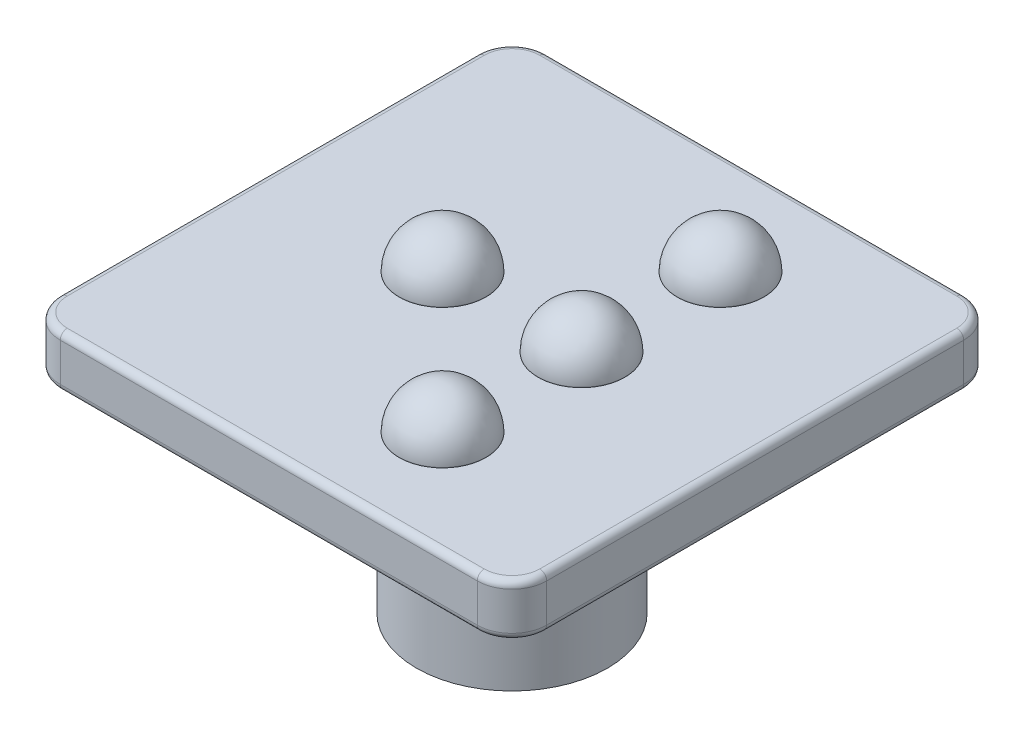
from build123d import *

# Parameters (mm, degrees)
BOSS_EXTRUDE1_DEPTH = 1.5
SKETCH2_R           = 2.75
BOSS_EXTRUDE2_DEPTH = 6
SKETCH3_W           = 1.1
SKETCH3_H           = 1.45
SKETCH3_W_2         = 1.45
SKETCH3_H_2         = 1.1
CUT_EXTRUDE1_DEPTH  = 6
CHAMFER1_SIZE       = 0.3
FILLET1_R           = 1
SKETCH4_R           = 1.25
BOSS_EXTRUDE3_DEPTH = 0.01
DOME2_FACE_RADIUS   = 1.25
DOME2_HEIGHT        = 1.25
DOME3_FACE_RADIUS   = 1.25
DOME3_HEIGHT        = 1.25
DOME4_FACE_RADIUS   = 1.25
DOME4_HEIGHT        = 1.25
DOME6_FACE_RADIUS   = 1.25
DOME6_HEIGHT        = 1.25
FILLET3_R           = 0.2


with BuildPart() as part:
    # Sketch1 → Boss-Extrude1 (new body)
    with BuildSketch(Plane(origin=(0, 0, 0), x_dir=(1, 0, 0), z_dir=(0, 1, 0))):
        with BuildLine():
            Line((-7.324675649, 4.396717546), (4.675324351, 4.396717546))
            ThreePointArc((4.675324351, 4.396717546), (5.382431132, 4.103824327), (5.675324351, 3.396717546))
            Line((5.675324351, 3.396717546), (5.675324351, -8.603282454))
            ThreePointArc((5.675324351, -8.603282454), (5.382431132, -9.310389235), (4.675324351, -9.603282454))
            Line((4.675324351, -9.603282454), (-7.324675649, -9.603282454))
            ThreePointArc((-7.324675649, -9.603282454), (-8.03178243, -9.310389235), (-8.324675649, -8.603282454))
            Line((-8.324675649, -8.603282454), (-8.324675649, 3.396717546))
            ThreePointArc((-8.324675649, 3.396717546), (-8.03178243, 4.103824327), (-7.324675649, 4.396717546))
        make_face()
    extrude(amount=BOSS_EXTRUDE1_DEPTH)

    # Sketch2 → Boss-Extrude2 (add)
    with BuildSketch(Plane.XZ):
        with Locations(Location((-1.324675649, 2.603282454, 0), (0, 0, 270))):
            Circle(SKETCH2_R)
    extrude(amount=BOSS_EXTRUDE2_DEPTH)

    # Sketch3 → Cut-Extrude1 (cut)
    with BuildSketch(Plane.XZ.offset(6)):
        with Locations((-1.324675649, 3.878282454)):
            Rectangle(SKETCH3_W, SKETCH3_H)
        with Locations((-0.049675649, 2.603282454)):
            Rectangle(SKETCH3_W_2, SKETCH3_H_2)
        with Locations((-1.324675649, 2.603282454)):
            Rectangle(SKETCH3_W, SKETCH3_H_2)
        with Locations((-2.599675649, 2.603282454)):
            Rectangle(SKETCH3_W_2, SKETCH3_H_2)
        with Locations((-1.324675649, 1.328282454)):
            Rectangle(SKETCH3_W, SKETCH3_H)
    extrude(amount=-CUT_EXTRUDE1_DEPTH, mode=Mode.SUBTRACT)

    # Chamfer1
    chamfer1_edges = [part.edges().sort_by_distance(p)[0] for p in [
        (-0.774675649, -6, 3.878282454),
        (-0.049675649, -6, 3.153282454),
        (0.675324351, -6, 2.603282454),
        (-0.774675649, -6, 1.328282454),
        (-2.599675649, -6, 3.153282454),
        (-1.324675649, -6, 4.603282454),
        (-1.874675649, -6, 3.878282454),
        (-3.324675649, -6, 2.603282454),
        (-2.599675649, -6, 2.053282454),
        (-1.874675649, -6, 1.328282454),
        (-1.324675649, -6, 0.603282454),
        (-0.049675649, -6, 2.053282454),
    ]]
    chamfer(chamfer1_edges, length=CHAMFER1_SIZE)

    # Fillet1
    fillet1_edges = [part.edges().sort_by_distance(p)[0] for p in [
        (-1.324675649, 0, 5.353282454),
    ]]
    fillet(fillet1_edges, radius=FILLET1_R)

    # Sketch4 → Boss-Extrude3 (add)
    with BuildSketch(Plane(origin=(0, 1.5, 0), x_dir=(1, 0, 0), z_dir=(0, 1, 0))):
        with Locations(Location((0.675324351, -2.603282454, 0), (0, 0, 90))):
            Circle(SKETCH4_R)
        with Locations(Location((-3.324675649, -2.603282454, 0), (0, 0, 90))):
            Circle(SKETCH4_R)
        with Locations(Location((0.675324351, -6.603282454, 0), (0, 0, 90))):
            Circle(SKETCH4_R)
        with Locations(Location((0.675324351, 1.396717546, 0), (0, 0, 90))):
            Circle(SKETCH4_R)
    extrude(amount=BOSS_EXTRUDE3_DEPTH)

    # Dome2: a dome of height H over a round flat face of radius A is a cap of a sphere of radius (A * A + H * H) / (2 * H)
    dome2_r = (DOME2_FACE_RADIUS * DOME2_FACE_RADIUS + DOME2_HEIGHT * DOME2_HEIGHT) / (2 * DOME2_HEIGHT)
    dome2_base = Plane((0.675324351, 1.51, -1.396717546), z_dir=(0, 1, 0))
    with Locations(dome2_base.offset(DOME2_HEIGHT - dome2_r)):
        dome2_ball = Sphere(dome2_r, mode=Mode.PRIVATE)
    add(split(dome2_ball, bisect_by=dome2_base, keep=Keep.TOP, mode=Mode.PRIVATE))

    # Dome3: a dome of height H over a round flat face of radius A is a cap of a sphere of radius (A * A + H * H) / (2 * H)
    dome3_r = (DOME3_FACE_RADIUS * DOME3_FACE_RADIUS + DOME3_HEIGHT * DOME3_HEIGHT) / (2 * DOME3_HEIGHT)
    dome3_base = Plane((-3.324675649, 1.51, 2.603282454), z_dir=(0, 1, 0))
    with Locations(dome3_base.offset(DOME3_HEIGHT - dome3_r)):
        dome3_ball = Sphere(dome3_r, mode=Mode.PRIVATE)
    add(split(dome3_ball, bisect_by=dome3_base, keep=Keep.TOP, mode=Mode.PRIVATE))

    # Dome4: a dome of height H over a round flat face of radius A is a cap of a sphere of radius (A * A + H * H) / (2 * H)
    dome4_r = (DOME4_FACE_RADIUS * DOME4_FACE_RADIUS + DOME4_HEIGHT * DOME4_HEIGHT) / (2 * DOME4_HEIGHT)
    dome4_base = Plane((0.675324351, 1.51, 2.603282454), z_dir=(0, 1, 0))
    with Locations(dome4_base.offset(DOME4_HEIGHT - dome4_r)):
        dome4_ball = Sphere(dome4_r, mode=Mode.PRIVATE)
    add(split(dome4_ball, bisect_by=dome4_base, keep=Keep.TOP, mode=Mode.PRIVATE))

    # Dome6: a dome of height H over a round flat face of radius A is a cap of a sphere of radius (A * A + H * H) / (2 * H)
    dome6_r = (DOME6_FACE_RADIUS * DOME6_FACE_RADIUS + DOME6_HEIGHT * DOME6_HEIGHT) / (2 * DOME6_HEIGHT)
    dome6_base = Plane((0.675324351, 1.51, 6.603282454), z_dir=(0, 1, 0))
    with Locations(dome6_base.offset(DOME6_HEIGHT - dome6_r)):
        dome6_ball = Sphere(dome6_r, mode=Mode.PRIVATE)
    add(split(dome6_ball, bisect_by=dome6_base, keep=Keep.TOP, mode=Mode.PRIVATE))

    # Fillet3
    fillet3_edges = [part.edges().sort_by_distance(p)[0] for p in [
        (5.382431132, 1.5, 9.310389235),
        (-1.324675649, 0, 9.603282454),
        (-8.03178243, 0, 9.310389235),
        (5.675324351, 1.5, 2.603282454),
        (5.382431132, 1.5, -4.103824327),
        (-1.324675649, 1.5, -4.396717546),
        (-8.03178243, 1.5, -4.103824327),
        (-8.324675649, 1.5, 2.603282454),
        (-8.03178243, 1.5, 9.310389235),
        (-1.324675649, 1.5, 9.603282454),
        (-8.324675649, 0, 2.603282454),
        (-8.03178243, 0, -4.103824327),
        (-1.324675649, 0, -4.396717546),
        (5.382431132, 0, -4.103824327),
        (5.675324351, 0, 2.603282454),
        (5.382431132, 0, 9.310389235),
    ]]
    fillet(fillet3_edges, radius=FILLET3_R)


solid = part.part
